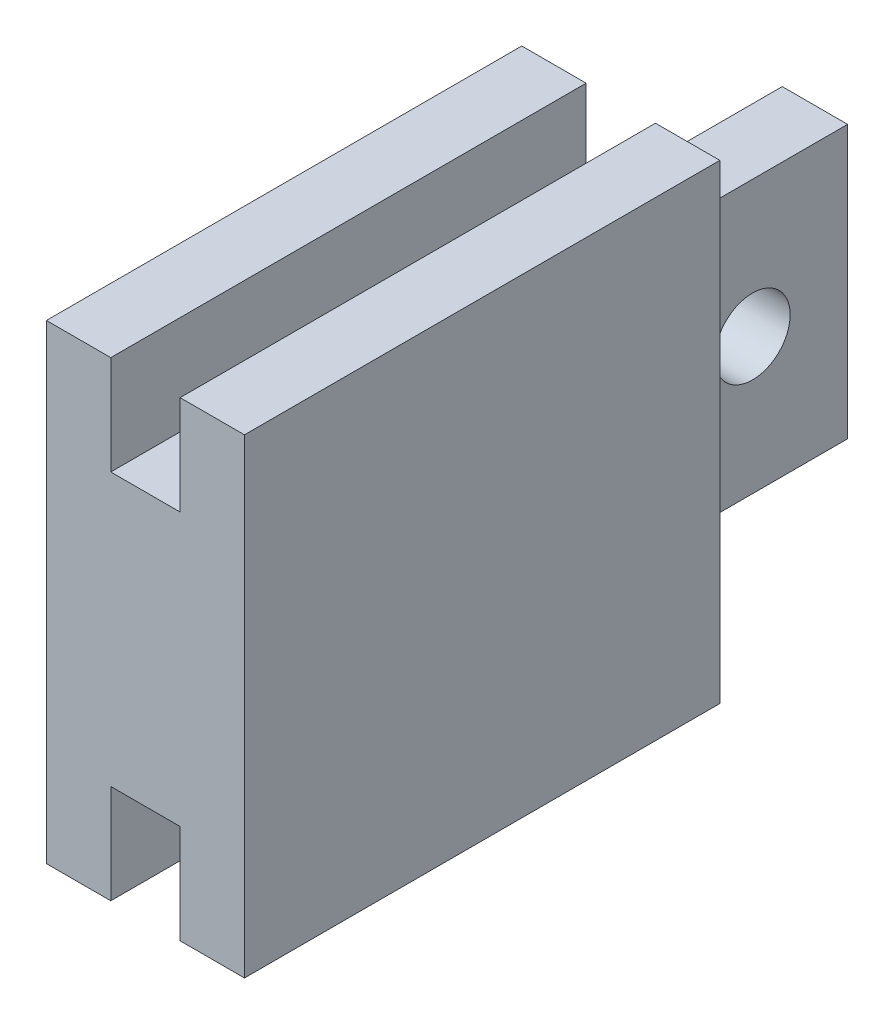
from build123d import *

# Parameters (mm, degrees)
SKETCH1_W           = 23.75
SKETCH1_H           = 24
BOSS_EXTRUDE1_DEPTH = 10
SKETCH2_W           = 3.3
SKETCH2_H           = 9.8
BOSS_EXTRUDE2_DEPTH = 23.75
CUT_EXTRUDE1_REACH  = 36.413
SKETCH4_R           = 1.9
SKETCH5_W           = 3.5
SKETCH5_H           = 3.25
SKETCH5_H_2         = 17.5
SKETCH5_W_2         = 3.3
SKETCH5_H_3         = 9.8
CUT_EXTRUDE2_DEPTH  = 5


with BuildPart() as part:
    # Sketch1 → Boss-Extrude1 (new body)
    with BuildSketch(Plane.YZ):
        with Locations((11.875, 12)):
            Rectangle(SKETCH1_W, SKETCH1_H)
    extrude(amount=-BOSS_EXTRUDE1_DEPTH)

    # Sketch2 → Boss-Extrude2 (add, through all)
    with BuildSketch(Plane.XZ):
        with Locations((-5, -4.9)):
            Rectangle(SKETCH2_W, SKETCH2_H)
    extrude(amount=-BOSS_EXTRUDE2_DEPTH)

    # Sketch4 → Cut-Extrude1 (cut, up to next)
    with BuildSketch(Plane(origin=(-6.65, 0, 0), x_dir=(0, -1, 0), z_dir=(-1, 0, 0)), mode=Mode.PRIVATE) as cut_extrude1_sk1:
        with Locations(Location((-11.875, -5, 0), (0, 0, 90))):
            Circle(SKETCH4_R)
    cut_extrude1_tool1 = extrude(cut_extrude1_sk1.sketch, amount=-CUT_EXTRUDE1_REACH, mode=Mode.PRIVATE) & part.part
    add(cut_extrude1_tool1.solids().sort_by_distance((-6.65, 11.875, -5))[0], mode=Mode.SUBTRACT)

    # Sketch5 → Cut-Extrude2 (cut)
    with BuildSketch(Plane(origin=(0, 23.75, 0), x_dir=(-1, 0, 0), z_dir=(0, 1, 0))):
        with Locations((5, 22.375)):
            Rectangle(SKETCH5_W, SKETCH5_H)
        with Locations((5, 12)):
            Rectangle(SKETCH5_W, SKETCH5_H_2)
        Polygon((6.75, 3.25), (3.25, 3.25), (3.25, 0), (3.35, 0), (6.65, 0), (6.75, 0), align=None)
        with Locations((5, -4.9)):
            Rectangle(SKETCH5_W_2, SKETCH5_H_3)
    cut_extrude2 = extrude(amount=-CUT_EXTRUDE2_DEPTH, mode=Mode.SUBTRACT)

    # Mirror1: Cut-Extrude2 across plane
    add(cut_extrude2.mirror(Plane.ZX.offset(11.875)), mode=Mode.SUBTRACT)


solid = part.part
